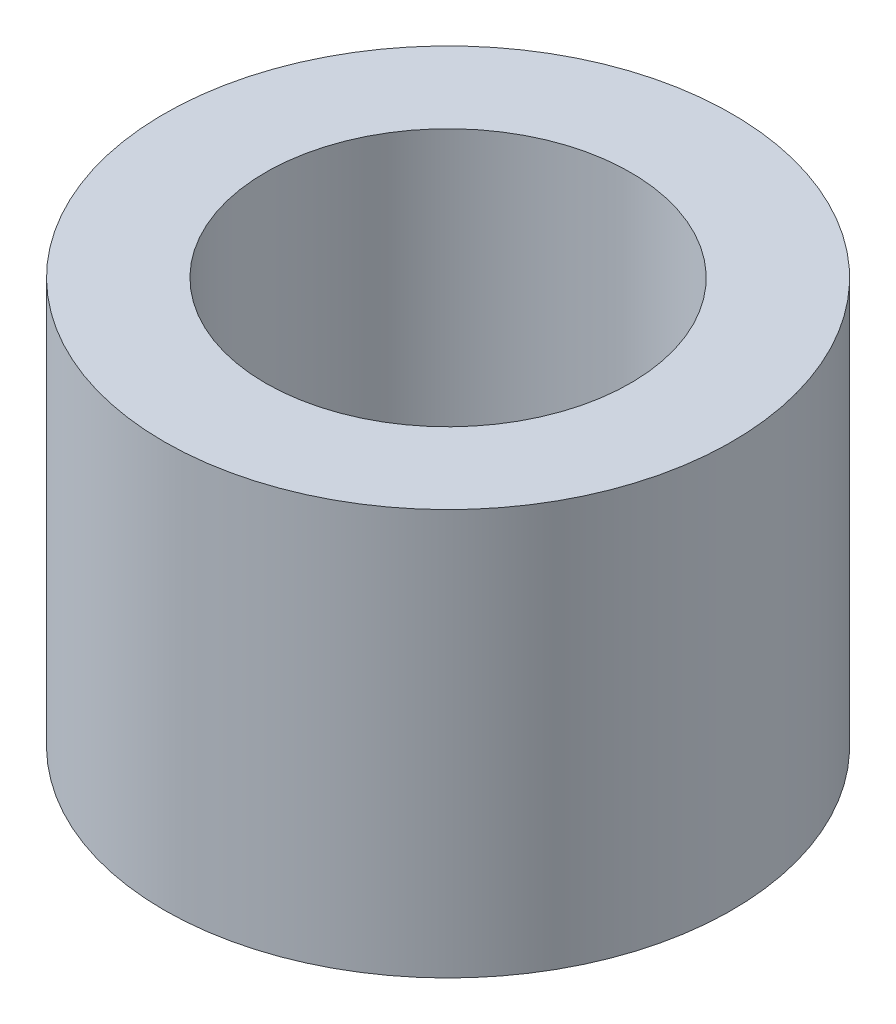
from build123d import *

# Parameters (mm, degrees)
SKETCH1_R           = 3.5
BOSS_EXTRUDE1_DEPTH = 5
SKETCH4_R           = 2.25
CUT_EXTRUDE1_DEPTH  = 8.03562364


with BuildPart() as part:
    # Sketch1 → Boss-Extrude1 (new body)
    with BuildSketch(Plane(origin=(0, 0, 0), x_dir=(1, 0, 0), z_dir=(0, 1, 0))):
        with Locations(Location((0, 0, 0), (0, 0, 270))):
            Circle(SKETCH1_R)
    extrude(amount=BOSS_EXTRUDE1_DEPTH)

    # Sketch4 → Cut-Extrude1 (cut, through all)
    with BuildSketch(Plane(origin=(0, 5, 0), x_dir=(1, 0, 0), z_dir=(0, 1, 0))):
        with Locations(Location((0, 0, 0), (0, 0, 270))):
            Circle(SKETCH4_R)
    extrude(amount=-CUT_EXTRUDE1_DEPTH, mode=Mode.SUBTRACT)


solid = part.part
